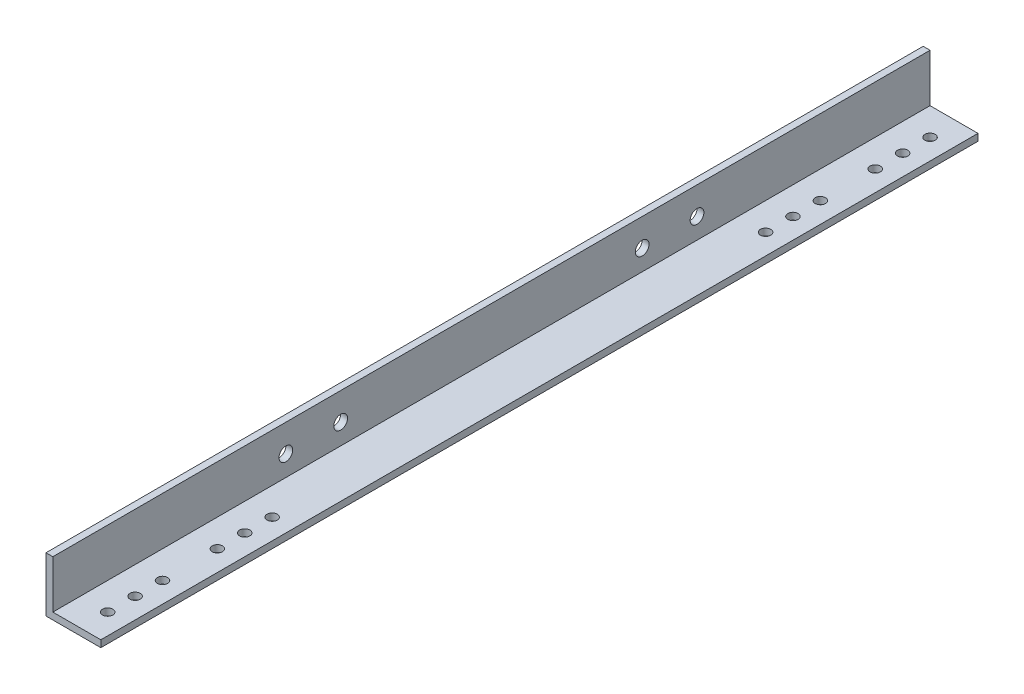
from build123d import *

# Parameters (mm, degrees)
BOSS_EXTRUDE1_DEPTH = 406.4
SKETCH2_R           = 2.38125
CUT_EXTRUDE1_DEPTH  = 408.799056675
SKETCH3_R           = 3.175
CUT_EXTRUDE2_DEPTH  = 408.984411467


with BuildPart() as part:
    # Sketch1 → Boss-Extrude1 (new body)
    with BuildSketch(Plane.XY):
        Polygon((0, 0), (25.4, 0), (25.4, 3.175), (3.175, 3.175), (3.175, 25.4), (0, 25.4), align=None)
    extrude(amount=BOSS_EXTRUDE1_DEPTH)

    # Sketch2 → Cut-Extrude1 (cut, through all)
    with BuildSketch(Plane(origin=(0, 3.175, 0), x_dir=(1, 0, 0), z_dir=(0, 1, 0))):
        with Locations((15.875, -393.7)):
            Circle(SKETCH2_R)
        with Locations((15.875, -381)):
            Circle(SKETCH2_R)
        with Locations((15.875, -368.3)):
            Circle(SKETCH2_R)
        with Locations((15.875, -317.5)):
            Circle(SKETCH2_R)
        with Locations((15.875, -330.2)):
            Circle(SKETCH2_R)
        with Locations((15.875, -342.9)):
            Circle(SKETCH2_R)
        with Locations((15.875, -12.7)):
            Circle(SKETCH2_R)
        with Locations((15.875, -25.4)):
            Circle(SKETCH2_R)
        with Locations((15.875, -38.1)):
            Circle(SKETCH2_R)
        with Locations((15.875, -63.5)):
            Circle(SKETCH2_R)
        with Locations((15.875, -76.2)):
            Circle(SKETCH2_R)
        with Locations((15.875, -88.9)):
            Circle(SKETCH2_R)
    extrude(amount=-CUT_EXTRUDE1_DEPTH, mode=Mode.SUBTRACT)

    # Sketch3 → Cut-Extrude2 (cut, through all)
    with BuildSketch(Plane.ZY):
        with Locations((107.95, 12.7)):
            Circle(SKETCH3_R)
        with Locations((133.35, 12.7)):
            Circle(SKETCH3_R)
        with Locations((273.05, 12.7)):
            Circle(SKETCH3_R)
        with Locations((298.45, 12.7)):
            Circle(SKETCH3_R)
    extrude(amount=-CUT_EXTRUDE2_DEPTH, mode=Mode.SUBTRACT)


solid = part.part
